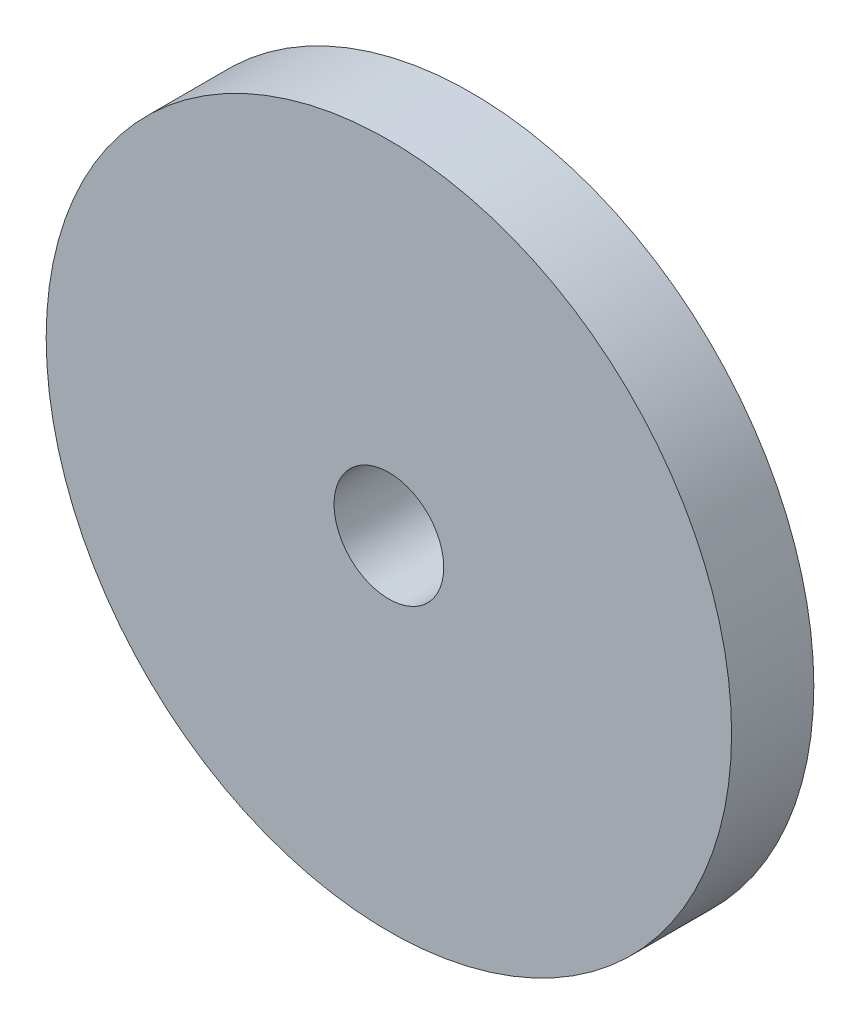
from build123d import *

# Parameters (mm, degrees)
SKETCH1_R           = 25
BOSS_EXTRUDE1_DEPTH = 6
SKETCH2_R           = 4
CUT_EXTRUDE1_DEPTH  = 36.860842154


with BuildPart() as part:
    # Sketch1 → Boss-Extrude1 (new body)
    with BuildSketch(Plane.XY):
        Circle(SKETCH1_R)
    extrude(amount=BOSS_EXTRUDE1_DEPTH)

    # Sketch2 → Cut-Extrude1 (cut, through all)
    with BuildSketch(Plane.XY.offset(6)):
        Circle(SKETCH2_R)
    extrude(amount=-CUT_EXTRUDE1_DEPTH, mode=Mode.SUBTRACT)


solid = part.part
